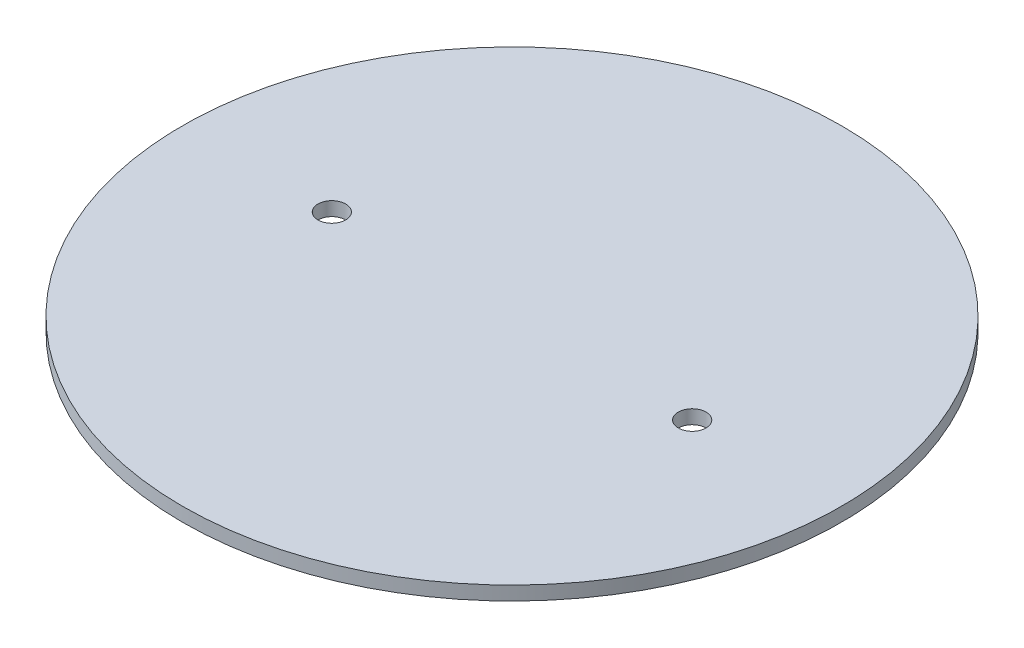
from build123d import *

# Parameters (mm, degrees)
SKETCH2_R           = 75.4888
BOSS_EXTRUDE1_DEPTH = 3.175
SKETCH8_R           = 3.175
CUT_EXTRUDE5_DEPTH  = 4.7625


with BuildPart() as part:
    # Sketch2 → Boss-Extrude1 (new body)
    with BuildSketch(Plane(origin=(0, 0, 0), x_dir=(1, 0, 0), z_dir=(0, 1, 0))):
        Circle(SKETCH2_R)
    extrude(amount=BOSS_EXTRUDE1_DEPTH)

    # Sketch8 → Cut-Extrude5 (cut)
    with BuildSketch(Plane(origin=(0, 3.175, 0), x_dir=(1, 0, 0), z_dir=(0, 1, 0))):
        with Locations((-41.275, 0)):
            Circle(SKETCH8_R)
        with Locations((41.275, 0)):
            Circle(SKETCH8_R)
    extrude(amount=-CUT_EXTRUDE5_DEPTH, mode=Mode.SUBTRACT)


solid = part.part
